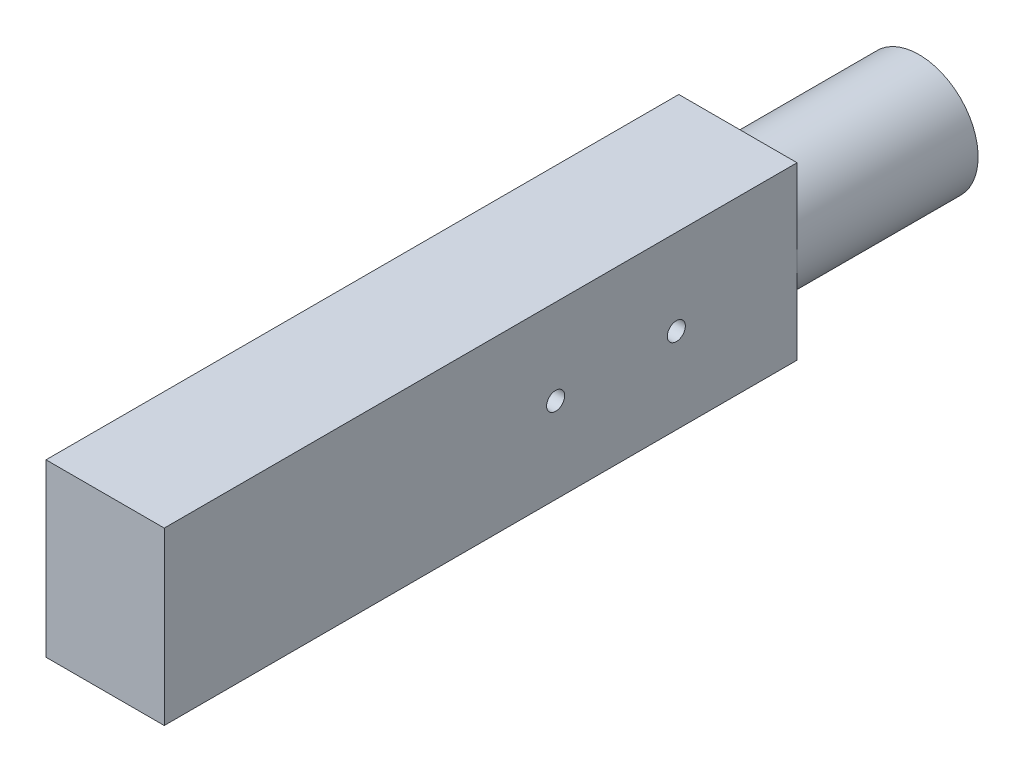
from build123d import *

# Parameters (mm, degrees)
SKETCH1_W           = 19.59343046
SKETCH1_H           = 28.33511482
BOSS_EXTRUDE1_DEPTH = 104.84505691
SKETCH2_R           = 9.79671523
BOSS_EXTRUDE2_DEPTH = 30
SKETCH3_R           = 1.5
CUT_EXTRUDE1_DEPTH  = 111.359717323


with BuildPart() as part:
    # Sketch1 → Boss-Extrude1 (new body)
    with BuildSketch(Plane.XY):
        with Locations((9.79671523, 14.16755741)):
            Rectangle(SKETCH1_W, SKETCH1_H)
    extrude(amount=BOSS_EXTRUDE1_DEPTH)

    # Sketch2 → Boss-Extrude2 (add)
    with BuildSketch(Plane(origin=(0, 0, 0), x_dir=(-1, 0, 0), z_dir=(0, 0, -1))):
        with Locations((-9.79671523, 14.16755741)):
            Circle(SKETCH2_R)
    extrude(amount=BOSS_EXTRUDE2_DEPTH)

    # Sketch3 → Cut-Extrude1 (cut, through all)
    with BuildSketch(Plane(origin=(19.59343046, 0, 0), x_dir=(0, 0, -1), z_dir=(1, 0, 0))):
        with Locations((-20, 14.16755741)):
            Circle(SKETCH3_R)
        with Locations((-40, 14.16755741)):
            Circle(SKETCH3_R)
    extrude(amount=-CUT_EXTRUDE1_DEPTH, mode=Mode.SUBTRACT)


solid = part.part
